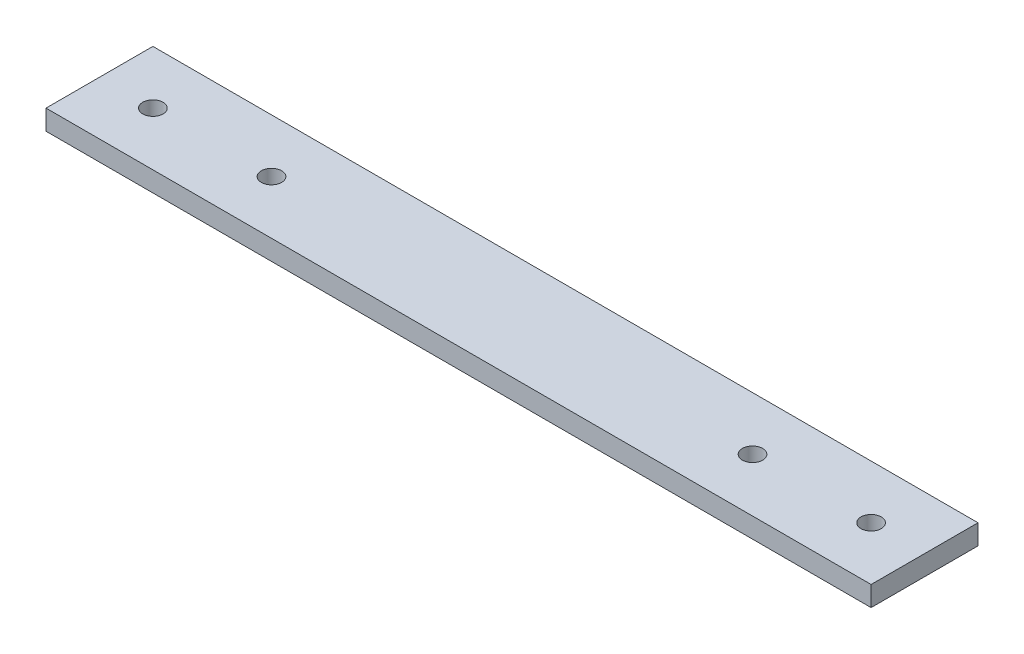
from build123d import *

# Parameters (mm, degrees)
SKETCH1_W           = 196.0626
SKETCH1_H           = 25.4
BOSS_EXTRUDE1_DEPTH = 4.7625
SKETCH2_R           = 2.413
CUT_EXTRUDE1_DEPTH  = 99.965181685


with BuildPart() as part:
    # Sketch1 → Boss-Extrude1 (new body)
    with BuildSketch(Plane(origin=(0, 0, 0), x_dir=(1, 0, 0), z_dir=(0, 1, 0))):
        Rectangle(SKETCH1_W, SKETCH1_H)
    extrude(amount=BOSS_EXTRUDE1_DEPTH)

    # Sketch2 → Cut-Extrude1 (cut, through all)
    with BuildSketch(Plane(origin=(0, 4.7625, 0), x_dir=(1, 0, 0), z_dir=(0, 1, 0))):
        with Locations(Location((-57.15, 0, 0), (0, 0, 270))):
            Circle(SKETCH2_R)
        with Locations(Location((57.15, 0, 0), (0, 0, 270))):
            Circle(SKETCH2_R)
        with Locations(Location((-85.3313, 0, 0), (0, 0, 270))):
            Circle(SKETCH2_R)
        with Locations(Location((85.3313, 0, 0), (0, 0, 270))):
            Circle(SKETCH2_R)
    extrude(amount=-CUT_EXTRUDE1_DEPTH, mode=Mode.SUBTRACT)


solid = part.part
